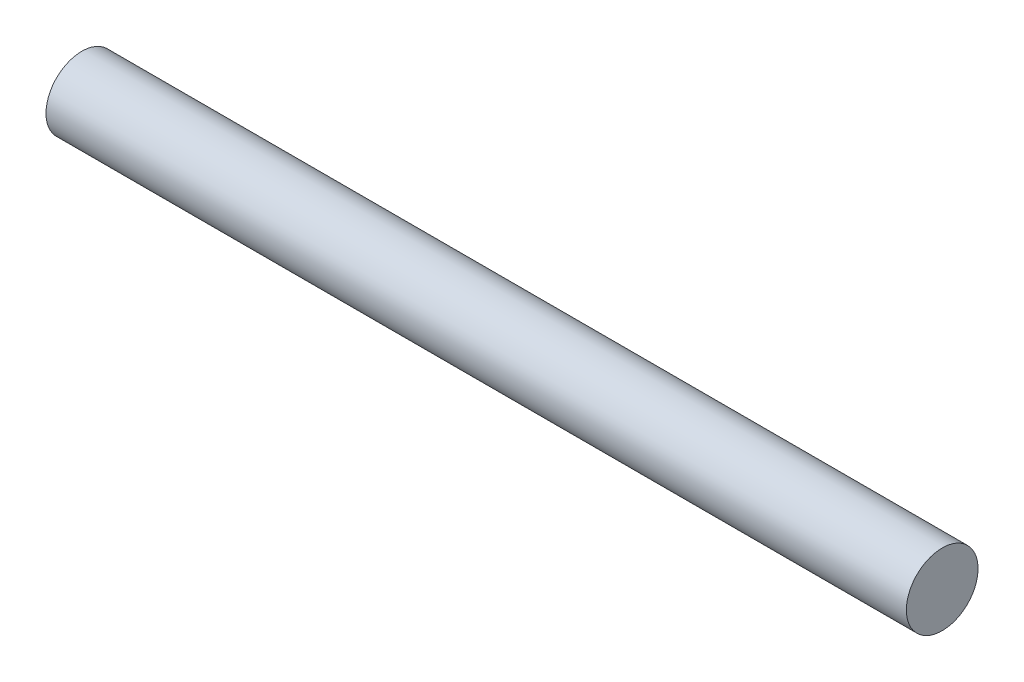
from build123d import *

# Parameters (mm, degrees)
SKETCH1_R           = 6.35
BOSS_EXTRUDE1_DEPTH = 152.4


with BuildPart() as part:
    # Sketch1 → Boss-Extrude1 (new body)
    with BuildSketch(Plane(origin=(0, 0, 0), x_dir=(0, 0, -1), z_dir=(1, 0, 0))):
        with Locations(Location((0, 0, 0), (0, 0, 180))):
            Circle(SKETCH1_R)
    extrude(amount=BOSS_EXTRUDE1_DEPTH)


solid = part.part
